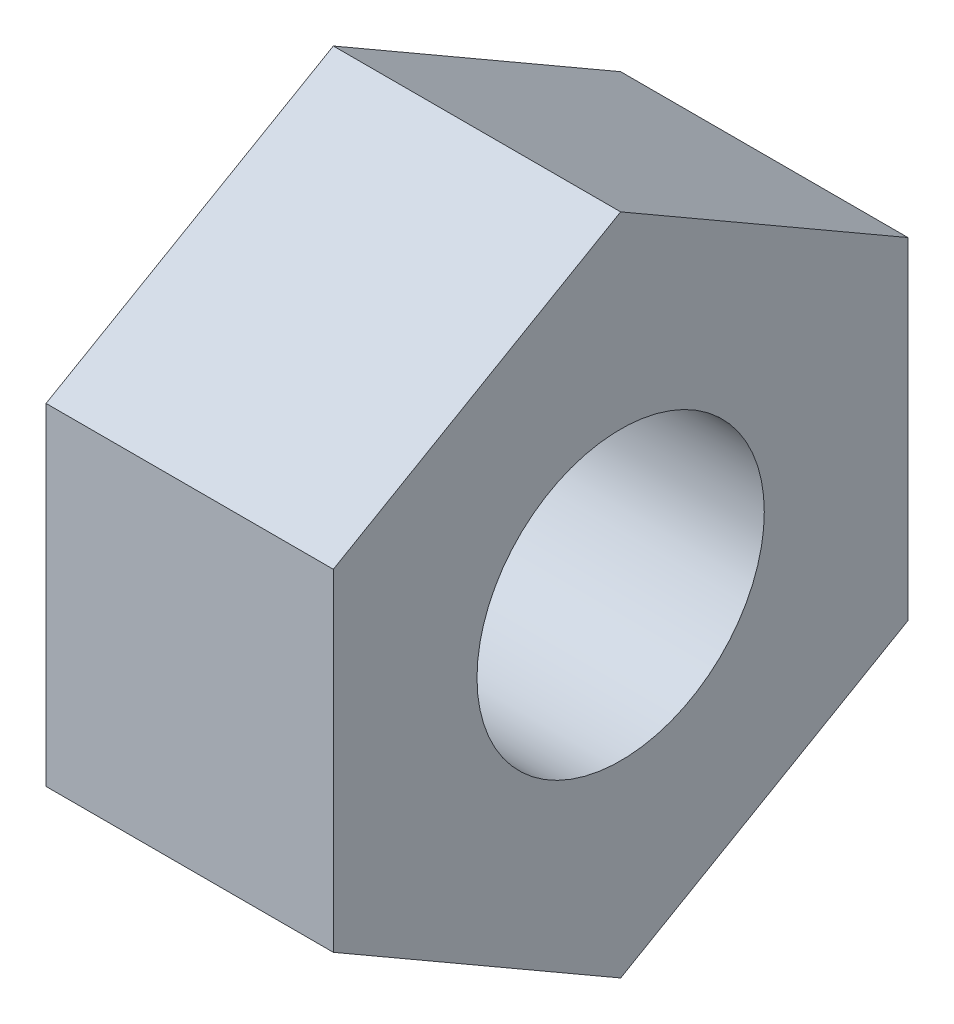
from build123d import *

# Parameters (mm, degrees)
SKETCH_2_R      = 1
EXTRUDE_1_DEPTH = 2


with BuildPart() as part:
    # 草图2 → 凸台-拉伸1 (new body)
    with BuildSketch(Plane(origin=(0, 0, 0), x_dir=(0, 0, -1), z_dir=(1, 0, 0))):
        Polygon((0, 2.309401077), (-2, 1.154700538), (-2, -1.154700538), (0, -2.309401077), (2, -1.154700538), (2, 1.154700538), align=None)
        Circle(SKETCH_2_R, mode=Mode.SUBTRACT)
    extrude(amount=EXTRUDE_1_DEPTH)


solid = part.part
